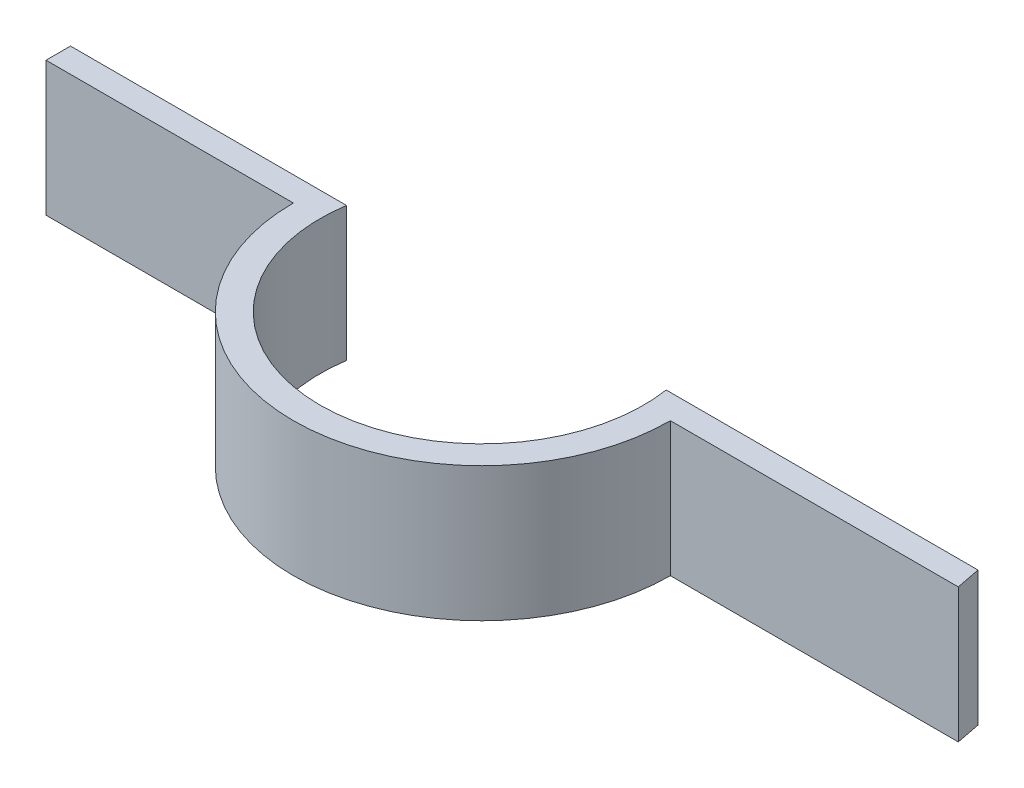
from build123d import *

# Parameters (mm, degrees)
BOSS_EXTRUDE2_DEPTH = 5


with BuildPart() as part:
    # Sketch1 → Boss-Extrude2 (new body)
    with BuildSketch(Plane(origin=(0, 0, 0), x_dir=(1, 0, 0), z_dir=(0, 1, 0))):
        with BuildLine():
            Line((-7.01988506, 0), (-16.23167261, 0))
            Line((-16.23167261, 0), (-16.23167261, 0.912169861))
            Line((-16.23167261, 0.912169861), (-5.951933661, 0.912169861))
            ThreePointArc((-5.951933661, 0.912169861), (0, -6.021425759), (5.951933661, 0.912169861))
            Line((5.951933661, 0.912169861), (17.563290649, 0.912169861))
            Line((17.563290649, 0.912169861), (17.741514741, 0))
            Line((17.741514741, 0), (7.01988506, 0))
            ThreePointArc((7.01988506, 0), (0, -7.01988506), (-7.01988506, 0))
        make_face()
    extrude(amount=BOSS_EXTRUDE2_DEPTH)


solid = part.part
